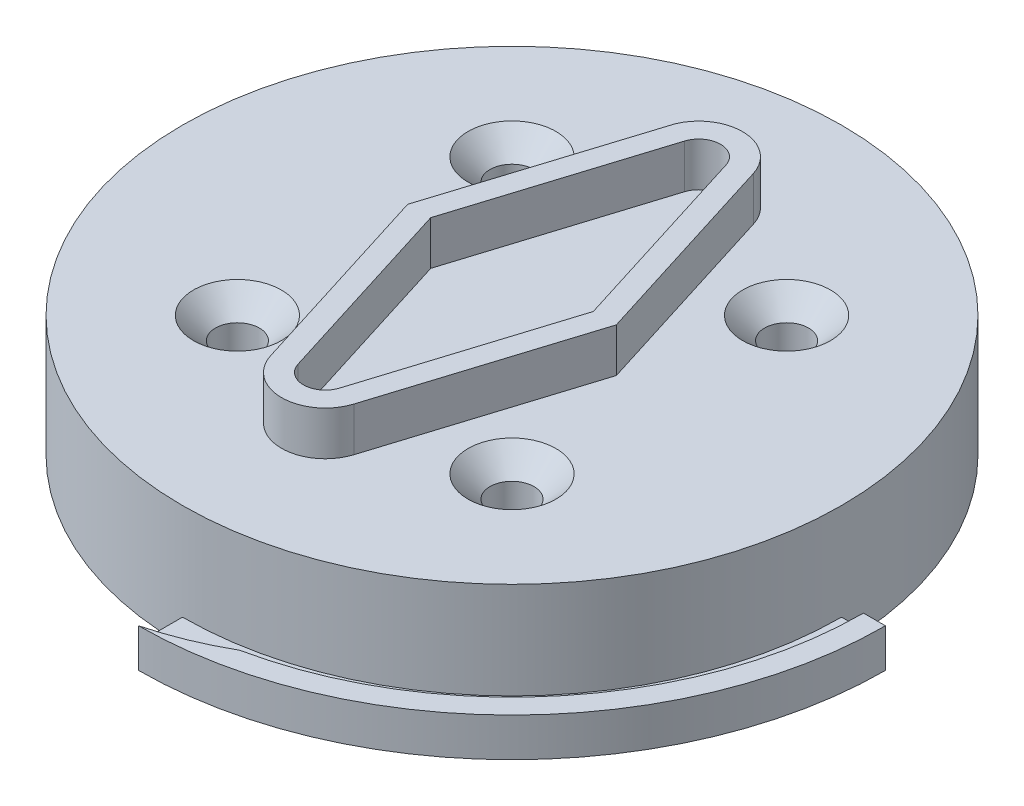
from build123d import *

# Parameters (mm, degrees)
SKETCH_1_R          = 30
EXTRUDE_1_DEPTH     = 11
EXTRUDE_2_DEPTH     = 4
CUT_EXTRUDE_1_DEPTH = 1.32
SKETCH_8_R          = 2
CUT_EXTRUDE_2_DEPTH = 50.325449821
CHAMFER_2_SIZE      = 2
EXTRUDE_4_DEPTH     = 4


with BuildPart() as part:
    # 草图1 → 凸台-拉伸1 (new body)
    with BuildSketch(Plane(origin=(0, 0, 0), x_dir=(1, 0, 0), z_dir=(0, 1, 0))):
        with Locations(Location((0, 0, 0), (0, 0, 270))):
            Circle(SKETCH_1_R)
    extrude(amount=EXTRUDE_1_DEPTH)

    # 草图3 → 凸台-拉伸2 (add)
    with BuildSketch(Plane.XZ):
        with BuildLine():
            Line((-34, 0), (-30, 0))
            ThreePointArc((-30, 0), (-21.213203436, -21.213203436), (0, -30))
            Line((0, -30), (0, -34))
            ThreePointArc((0, -34), (-24.04163056, -24.04163056), (-34, 0))
        make_face()
        with BuildLine():
            Line((0, 34), (0, 30))
            ThreePointArc((0, 30), (21.213203436, 21.213203436), (30, 0))
            Line((30, 0), (34, 0))
            ThreePointArc((34, 0), (24.04163056, 24.04163056), (0, 34))
        make_face()
    extrude(amount=-EXTRUDE_2_DEPTH)

    # 草图6 → 切除-旋转8 (revolve, cut)
    with BuildSketch(Plane(origin=(0, 0, 0), x_dir=(-1, 0, 0), z_dir=(0, 0, -1)), mode=Mode.PRIVATE) as cut_revolve_8_sk:
        Polygon((-30, 2.2), (-32, 2.2), (-32, 3.52), (-34, 3.52), (-34, 4), (-30, 4), align=None)
    revolve(cut_revolve_8_sk.sketch.rotate(Axis((0, 0, 0), (0, 1, 0)), 270), axis=Axis((0, 0, 0), (0, 1, 0)), mode=Mode.SUBTRACT)

    # 草图7 → 切除-拉伸1 (cut)
    with BuildSketch(Plane(origin=(0, 3.52, 0), x_dir=(1, 0, 0), z_dir=(0, 1, 0))):
        with BuildLine():
            Line((6.522408084, -31.328233158), (-2.191886095, -31.444458777))
            Line((-2.191886095, -31.444458777), (0, -34))
            ThreePointArc((0, -34), (3.348762467, -32.877867185), (6.522408084, -31.328233158))
        make_face()
        with BuildLine():
            Line((-6.522408084, 31.328233158), (2.581044054, 31.031256101))
            Line((2.581044054, 31.031256101), (0, 34))
            ThreePointArc((0, 34), (-3.348762467, 32.877867185), (-6.522408084, 31.328233158))
        make_face()
    extrude(amount=-CUT_EXTRUDE_1_DEPTH, mode=Mode.SUBTRACT)

    # 草图8 → 切除-拉伸2 (cut, through all)
    with BuildSketch(Plane(origin=(0, 11, 0), x_dir=(1, 0, 0), z_dir=(0, 1, 0))):
        with BuildLine():
            ThreePointArc((14.5, 12.5), (13.914213562, 13.914213562), (12.5, 14.5))
            Line((12.5, 14.5), (12.5, 10.5))
            ThreePointArc((12.5, 10.5), (13.914213562, 11.085786438), (14.5, 12.5))
        make_face()
        with BuildLine():
            Line((12.5, 10.5), (12.5, 14.5))
            ThreePointArc((12.5, 14.5), (10.5, 12.5), (12.5, 10.5))
        make_face()
        with BuildLine():
            ThreePointArc((-12.5, -10.5), (-13.914213562, -11.085786438), (-14.5, -12.5))
            Line((-14.5, -12.5), (-12.5, -12.5))
            Line((-12.5, -12.5), (-12.5, -10.5))
        make_face()
        with BuildLine():
            Line((-12.5, -12.5), (-14.5, -12.5))
            ThreePointArc((-14.5, -12.5), (-13.914213562, -13.914213562), (-12.5, -14.5))
            Line((-12.5, -14.5), (-12.5, -12.5))
        make_face()
        with BuildLine():
            ThreePointArc((-10.5, -12.5), (-11.085786438, -11.085786438), (-12.5, -10.5))
            Line((-12.5, -10.5), (-12.5, -12.5))
            Line((-12.5, -12.5), (-10.5, -12.5))
        make_face()
        with BuildLine():
            Line((-10.5, -12.5), (-12.5, -12.5))
            Line((-12.5, -12.5), (-12.5, -14.5))
            ThreePointArc((-12.5, -14.5), (-11.085786438, -13.914213562), (-10.5, -12.5))
        make_face()
        with Locations(Location((12.5, -12.5, 0), (0, 0, 270))):
            Circle(SKETCH_8_R)
        with Locations(Location((-12.5, 12.5, 0), (0, 0, 270))):
            Circle(SKETCH_8_R)
    extrude(amount=-CUT_EXTRUDE_2_DEPTH, mode=Mode.SUBTRACT)

    # 倒角2
    chamfer_2_edges = [part.edges().sort_by_distance(p)[0] for p in [
        (-12.5, 11, -14.5),
        (12.5, 11, 10.5),
        (-12.5, 11, 10.5),
        (12.5, 11, -14.5),
    ]]
    chamfer(chamfer_2_edges, length=CHAMFER_2_SIZE)

    # 草图13 → 凸台-拉伸4 (add)
    with BuildSketch(Plane(origin=(0, 11, 0), x_dir=(1, 0, 0), z_dir=(0, 1, 0))):
        with BuildLine():
            Line((-3.896027989, 17.813244072), (-9.5, 0))
            Line((-9.5, 0), (-3.797777246, -18.190499049))
            ThreePointArc((-3.797777246, -18.190499049), (0, -20.98), (3.797777246, -18.190499049))
            Line((3.797777246, -18.190499049), (9.5, 0))
            Line((9.5, 0), (3.797777247, 18.190499048))
            ThreePointArc((3.797777247, 18.190499048), (0.198983725, 20.975022701), (-3.659900167, 18.563819291))
            Line((-3.659900167, 18.563819291), (-3.896027989, 17.813244072))
        make_face()
        with BuildLine():
            Line((-1.889470191, -17.591863495), (-7.4, 0))
            Line((-7.4, 0), (-1.889470192, 17.591863494))
            ThreePointArc((-1.889470192, 17.591863494), (0, 18.979999999), (1.889470191, 17.591863494))
            Line((1.889470191, 17.591863494), (7.4, 0))
            Line((7.4, 0), (1.889470191, -17.591863495))
            ThreePointArc((1.889470191, -17.591863495), (0, -18.98), (-1.889470191, -17.591863495))
        make_face(mode=Mode.SUBTRACT)
    extrude(amount=EXTRUDE_4_DEPTH)


solid = part.part
